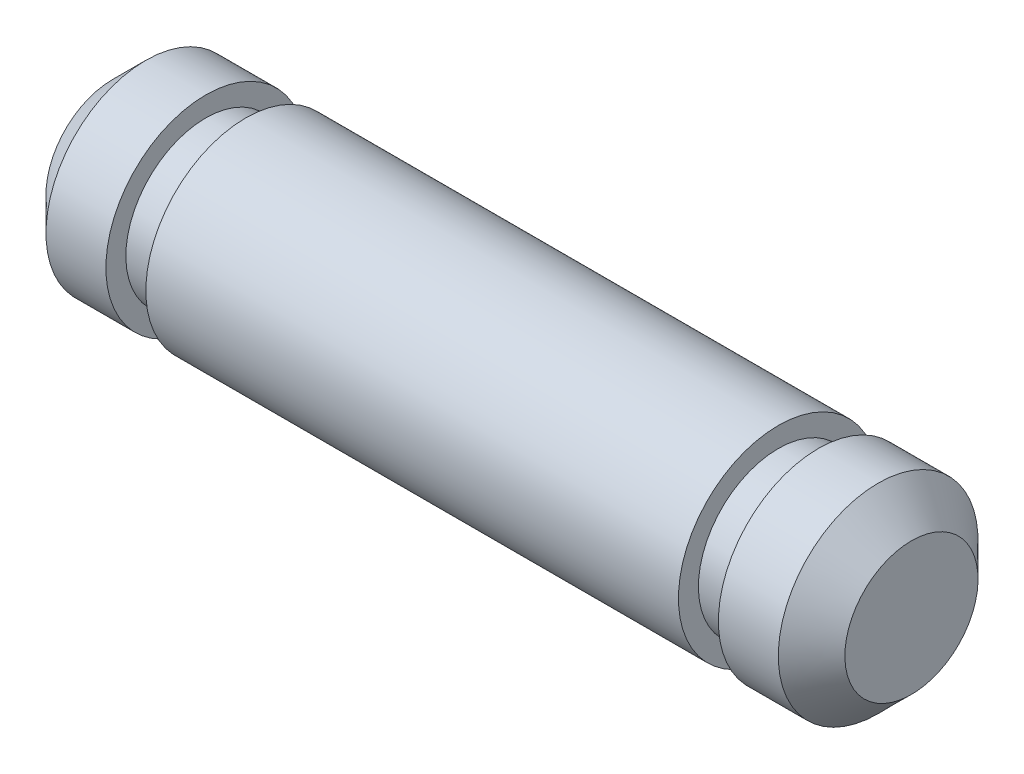
from build123d import *


with BuildPart() as part:
    # 草图1 → 旋转1 (revolve)
    with BuildSketch(Plane.XY):
        Polygon((6, 0), (-6, 0), (-6, 1), (-5.5, 1.5), (-4.6, 1.5), (-4.6, 1.2), (-4, 1.2), (-4, 1.5), (4, 1.5), (4, 1.2), (4.6, 1.2), (4.6, 1.5), (5.5, 1.5), (6, 1), align=None)
    revolve(axis=Axis((6, 0, 0), (-1, 0, 0)))


solid = part.part
